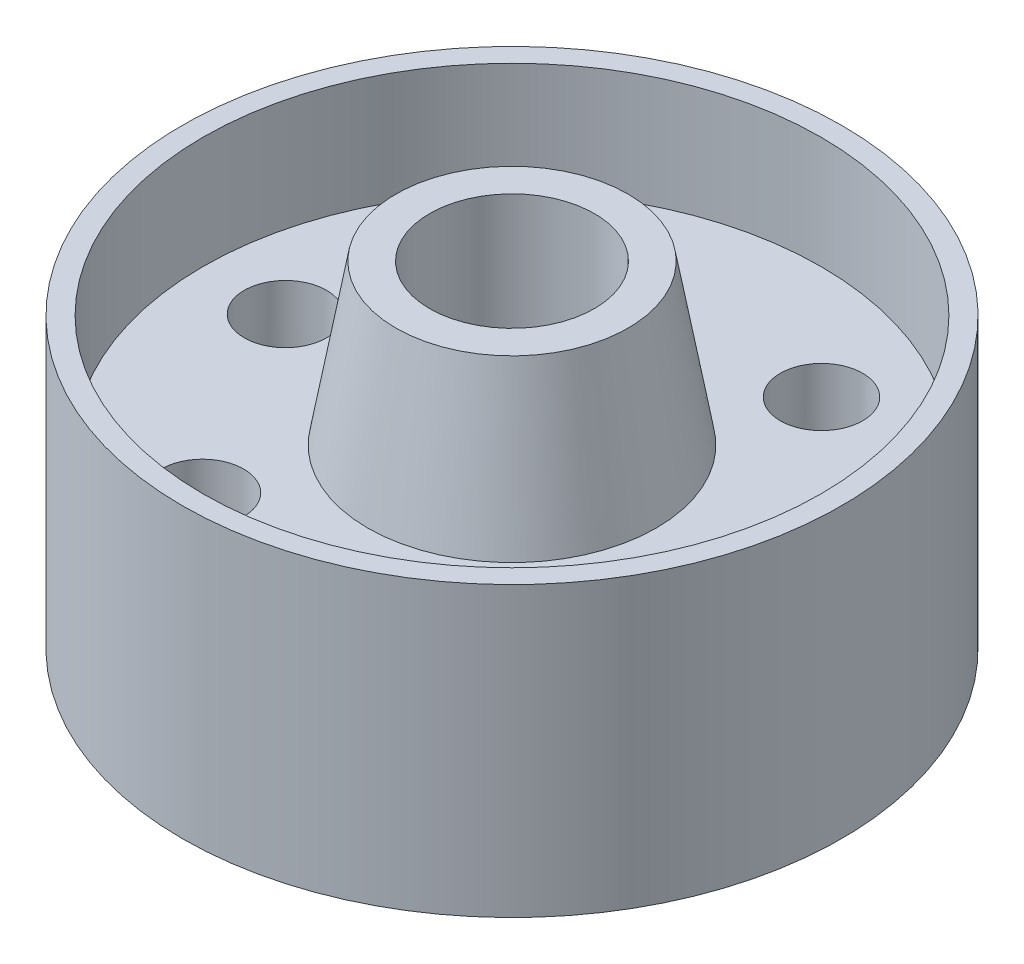
from build123d import *

# Parameters (mm, degrees)
SKETCH5_R          = 6.35
CUT_EXTRUDE1_DEPTH = 89.214152462


with BuildPart() as part:
    # Sketch1 → Revolve2 (revolve)
    with BuildSketch(Plane(origin=(0, 0, 0), x_dir=(0, 0, -1), z_dir=(1, 0, 0))):
        Polygon((-38.1, 0), (-38.1, 22.098), (-34.925, 22.098), (-34.925, 4.826), (-9.525, 4.826), (-5.198570671, 29.3624), (0, 29.3624), (0, -29.3624), (-5.198570671, -29.3624), (-9.525, -4.826), (-34.925, -4.826), (-34.925, -22.352), (-38.1, -22.352), align=None)
    revolve(axis=Axis((0, 29.3624, -12.7), (0, -1, 0)))

    # Sketch5 → Cut-Extrude1 (cut, through all)
    with BuildSketch(Plane(origin=(0, 4.826, 0), x_dir=(1, 0, 0), z_dir=(0, 1, 0))):
        with Locations(Location((-34.925, 12.7, 0), (0, 0, 270))):
            Circle(SKETCH5_R)
        with Locations(Location((34.925, 12.7, 0), (0, 0, 270))):
            Circle(SKETCH5_R)
        with Locations(Location((-17.4625, 42.945937227, 0), (0, 0, 270))):
            Circle(SKETCH5_R)
        with Locations(Location((17.4625, 42.945937227, 0), (0, 0, 270))):
            Circle(SKETCH5_R)
        with Locations(Location((-17.4625, -17.545937227, 0), (0, 0, 270))):
            Circle(SKETCH5_R)
        with Locations(Location((17.4625, -17.545937227, 0), (0, 0, 270))):
            Circle(SKETCH5_R)
    extrude(amount=-CUT_EXTRUDE1_DEPTH, mode=Mode.SUBTRACT)


solid = part.part
